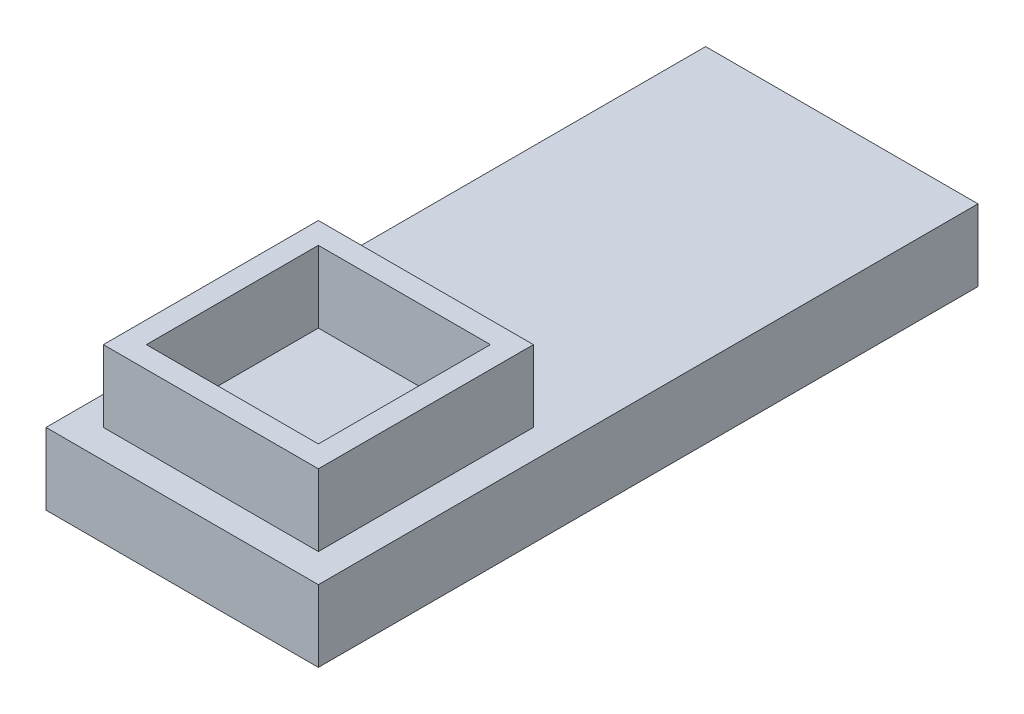
from build123d import *

# Parameters (mm, degrees)
SKETCH5_W           = 30
SKETCH5_H           = 30
SKETCH5_W_2         = 24
SKETCH5_H_2         = 24
BOSS_EXTRUDE4_DEPTH = 10
SKETCH6_W           = 38
SKETCH6_H           = 92.02563866
BOSS_EXTRUDE5_DEPTH = 10


with BuildPart() as part:
    # Sketch5 → Boss-Extrude4 (new body)
    with BuildSketch(Plane(origin=(0, 0, 0), x_dir=(1, 0, 0), z_dir=(0, 1, 0))):
        with Locations((3.417098749, 6.127681786)):
            Rectangle(SKETCH5_W, SKETCH5_H)
        with Locations((3.417098749, 6.127681786)):
            Rectangle(SKETCH5_W_2, SKETCH5_H_2, mode=Mode.SUBTRACT)
    extrude(amount=BOSS_EXTRUDE4_DEPTH)

    # Sketch6 → Boss-Extrude5 (add)
    with BuildSketch(Plane(origin=(0, 0, 0), x_dir=(1, 0, 0), z_dir=(0, 1, 0))):
        with Locations((3.417098749, 33.140501116)):
            Rectangle(SKETCH6_W, SKETCH6_H)
    extrude(amount=-BOSS_EXTRUDE5_DEPTH)


solid = part.part
